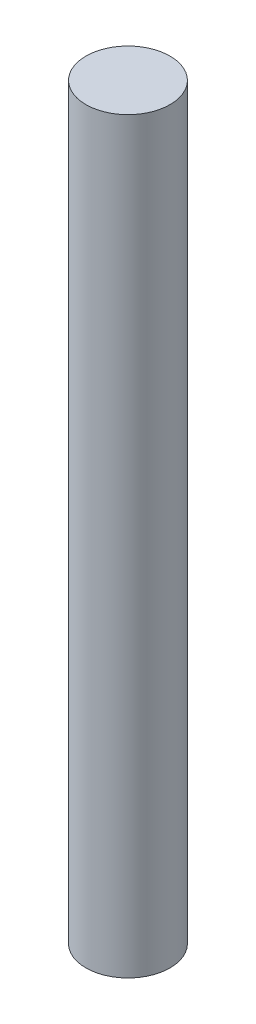
from build123d import *

# Parameters (mm, degrees)
SKETCH_1_R      = 2.25
EXTRUDE_1_DEPTH = 40


with BuildPart() as part:
    # 草图1 → 凸台-拉伸1 (new body)
    with BuildSketch(Plane(origin=(0, 0, 0), x_dir=(1, 0, 0), z_dir=(0, 1, 0))):
        with Locations(Location((0, 0, 0), (0, 0, 270))):
            Circle(SKETCH_1_R)
    extrude(amount=EXTRUDE_1_DEPTH)


solid = part.part
